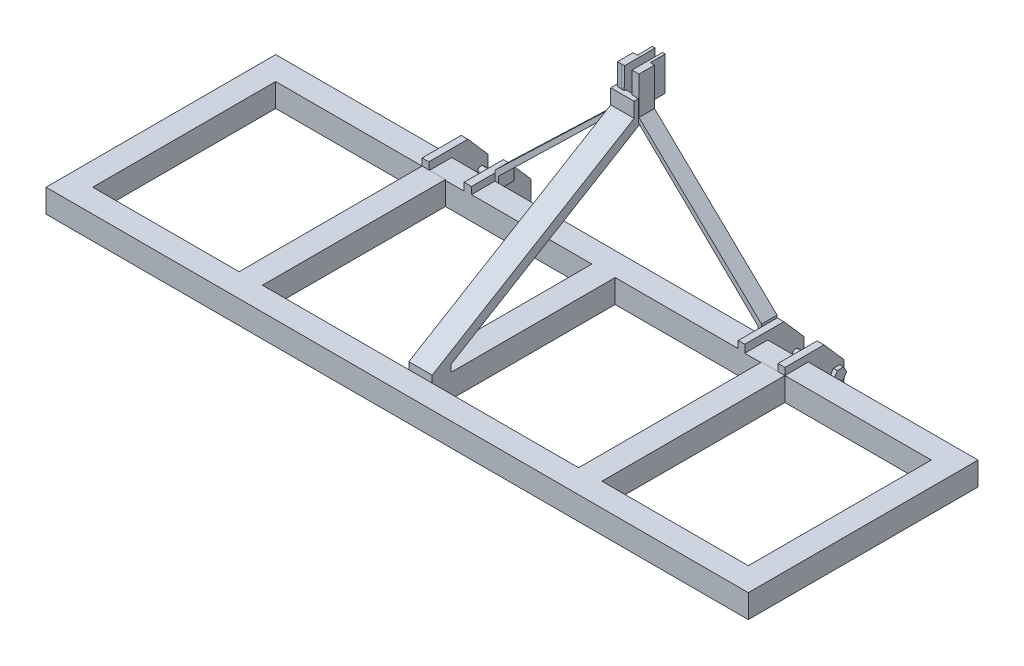
from build123d import *

# Parameters (mm, degrees)
SKETCH1_W            = 37.613618603
SKETCH1_H            = 47.017023253
SKETCH1_W_2          = 37.613618602
BOSS_EXTRUDE1_DEPTH  = 6
BOSS_EXTRUDE2_DEPTH  = 6
MIRROR3_COPY_1_DEPTH = 6
SKETCH6_W            = 8.533488923
SKETCH6_H            = 15.820834786
CUT_EXTRUDE2_DEPTH   = 2
SKETCH7_W            = 8.533488923
SKETCH7_H            = 10.900786406
CUT_EXTRUDE3_DEPTH   = 16
BOSS_EXTRUDE6_DEPTH  = 4
SKETCH9_W            = 9.784219632
SKETCH9_H            = 16.89117049
CUT_EXTRUDE4_DEPTH   = 2
SKETCH10_W           = 9.784219632
SKETCH10_H           = 11.02968992
CUT_EXTRUDE5_DEPTH   = 15
BOSS_EXTRUDE8_DEPTH  = 0.7
BOSS_EXTRUDE9_DEPTH  = 0.7
SKETCH15_W           = 7.842146402
SKETCH15_H           = 8.765171011
BOSS_EXTRUDE11_DEPTH = 0.7
BOSS_EXTRUDE12_DEPTH = 0.7
BOSS_EXTRUDE13_DEPTH = 0.7
BOSS_EXTRUDE15_DEPTH = 6
BOSS_EXTRUDE16_DEPTH = 1
SKETCH25_R           = 0.785617121
BOSS_EXTRUDE17_DEPTH = 13
BOSS_EXTRUDE18_DEPTH = 1
SKETCH27_R           = 0.813635411
BOSS_EXTRUDE19_DEPTH = 12


with BuildPart() as part:
    # Sketch1 → Boss-Extrude1 (new body)
    with BuildSketch(Plane(origin=(0, 0, 0), x_dir=(1, 0, 0), z_dir=(0, 1, 0))):
        Polygon((-163.115635978, 16.680412456), (-163.115635978, -40.614150466), (-163.115635978, -42.336610797), (17.338838432, -42.336610797), (17.338838432, 16.680412456), (16.48228959, 16.680412456), align=None)
        with Locations((-138.308826677, -12.82809917)):
            Rectangle(SKETCH1_W, SKETCH1_H, mode=Mode.SUBTRACT)
        with Locations((-94.695208074, -12.82809917)):
            Rectangle(SKETCH1_W_2, SKETCH1_H, mode=Mode.SUBTRACT)
        with Locations((-51.081589472, -12.82809917)):
            Rectangle(SKETCH1_W, SKETCH1_H, mode=Mode.SUBTRACT)
        with Locations((-7.467970869, -12.82809917)):
            Rectangle(SKETCH1_W_2, SKETCH1_H, mode=Mode.SUBTRACT)
    extrude(amount=BOSS_EXTRUDE1_DEPTH)

    # Sketch2 → Boss-Extrude2 (add)
    with BuildSketch(Plane.ZY.offset(119.502017375)):
        Polygon((-10.680412456, 6), (-10.680412456, 7.806965874), (-20.737358395, 7.806965874), (-25.925828115, 1.87209116), (-25.925828115, -3.073895358), (-25.925828115, -6.20063921), (-20.737358395, 0), (-16.680412456, 0), (-10.680412456, 0), align=None)
    boss_extrude2 = extrude(amount=-BOSS_EXTRUDE2_DEPTH)

    # Mirror2: Boss-Extrude2 across plane
    add(boss_extrude2.mirror(Plane(origin=(-75.888398773, 6, -10.680412456), x_dir=(0, 0, 1), z_dir=(-1, 0, 0))))

    # Mirror3 copy 1 sketch → Mirror3 copy 1 (add)
    with BuildSketch(Plane.ZY.offset(32.27478017)):
        Polygon((-10.680412456, 6), (-10.680412456, 7.806965874), (-20.737358395, 7.806965874), (-25.925828115, 1.87209116), (-25.925828115, -3.073895358), (-25.925828115, -6.20063921), (-20.737358395, 0), (-16.680412456, 0), (-10.680412456, 0), align=None)
    extrude(amount=-MIRROR3_COPY_1_DEPTH)

    # Mirror4: Boss-Extrude2 across plane
    add(boss_extrude2.mirror(Plane.ZY.offset(113.502017375)))

    # Sketch6 → Cut-Extrude2 (cut)
    with BuildSketch(Plane(origin=(0, 7.806965874, 0), x_dir=(1, 0, 0), z_dir=(0, 1, 0))):
        with Locations((-32.321100626, 18.590829849)):
            Rectangle(SKETCH6_W, SKETCH6_H)
    extrude(amount=-CUT_EXTRUDE2_DEPTH, mode=Mode.SUBTRACT)

    # Sketch7 → Cut-Extrude3 (cut)
    with BuildSketch(Plane(origin=(0, 5.806965874, 0), x_dir=(1, 0, 0), z_dir=(0, 1, 0))):
        with Locations((-32.321100626, 22.033512706)):
            Rectangle(SKETCH7_W, SKETCH7_H)
    extrude(amount=-CUT_EXTRUDE3_DEPTH, mode=Mode.SUBTRACT)

    # Sketch8 → Boss-Extrude6 (add)
    with BuildSketch(Plane(origin=(0, 0, -16.680412456), x_dir=(-1, 0, 0), z_dir=(0, 0, -1))):
        Polygon((38.27478017, 4.522273807), (38.27478017, 8.450147148), (69.772707479, 38.666586062), (69.772707479, 48.334730149), (70.874011488, 48.334730149), (70.874011488, 37.278255422), (69.772707479, 37.278255422), (39.158061482, 7.529405606), (39.158061482, 4.522273807), align=None)
    boss_extrude6 = extrude(amount=BOSS_EXTRUDE6_DEPTH)

    # Sketch9 → Cut-Extrude4 (cut)
    with BuildSketch(Plane(origin=(0, 7.806965874, 0), x_dir=(1, 0, 0), z_dir=(0, 1, 0))):
        with Locations((-113.591226463, 19.125997701)):
            Rectangle(SKETCH9_W, SKETCH9_H)
    extrude(amount=-CUT_EXTRUDE4_DEPTH, mode=Mode.SUBTRACT)

    # Sketch10 → Cut-Extrude5 (cut)
    with BuildSketch(Plane(origin=(0, 5.806965874, 0), x_dir=(1, 0, 0), z_dir=(0, 1, 0))):
        with Locations((-113.591226463, 22.097964463)):
            Rectangle(SKETCH10_W, SKETCH10_H)
    extrude(amount=-CUT_EXTRUDE5_DEPTH, mode=Mode.SUBTRACT)

    # Mirror7: Boss-Extrude6 across plane
    add(boss_extrude6.mirror(Plane(origin=(-72.533385445, 0, 0), x_dir=(0, 0, 1), z_dir=(1, 0, 0))))

    # Sketch12 → Boss-Extrude8 (add)
    with BuildSketch(Plane(origin=(-107.502017375, 0, 0), x_dir=(0, 0, -1), z_dir=(1, 0, 0))):
        Polygon((16.680412456, 6), (16.680412456, 0), (20.737358395, 0), (25.925828115, -6.20063921), (25.925828115, 1.87209116), (20.737358395, 7.806965874), (10.680412456, 7.806965874), (10.680412456, 6), align=None)
    extrude(amount=BOSS_EXTRUDE8_DEPTH)

    # Sketch14 → Boss-Extrude9 (add)
    with BuildSketch(Plane(origin=(-118.483336279, 0, 0), x_dir=(0, 0, -1), z_dir=(1, 0, 0))):
        Polygon((16.583119503, 0), (16.583119503, 5.806965874), (10.680412456, 5.806965874), (10.680412456, 7.806965874), (20.737358395, 7.806965874), (25.925828115, 1.87209116), (25.925828115, -6.20063921), (20.737358395, 0), align=None)
    extrude(amount=BOSS_EXTRUDE9_DEPTH)

    # Sketch15 → Boss-Extrude11 (add)
    with BuildSketch(Plane.ZY.offset(70.874011488)):
        with Locations((-20.601485657, 43.952144644)):
            Rectangle(SKETCH15_W, SKETCH15_H)
    extrude(amount=BOSS_EXTRUDE11_DEPTH)

    # Sketch19 → Boss-Extrude12 (add)
    with BuildSketch(Plane(origin=(-74.192759403, 0, 0), x_dir=(0, 0, -1), z_dir=(1, 0, 0))):
        Polygon((20.680412456, 48.334730149), (20.754843595, 39.792896823), (16.566782326, 39.792896823), (16.680412456, 48.334730149), align=None)
    extrude(amount=BOSS_EXTRUDE12_DEPTH)

    # Sketch21 → Boss-Extrude13 (add)
    with BuildSketch(Plane(origin=(-74.192759403, 0, 0), x_dir=(0, 0, -1), z_dir=(1, 0, 0))):
        Polygon((20.754843595, 39.792896823), (24.537534544, 39.792896823), (24.537534544, 48.362951427), (20.680412456, 48.334730149), align=None)
    extrude(amount=BOSS_EXTRUDE13_DEPTH)

    # Sketch23 → Boss-Extrude15 (add)
    with BuildSketch(Plane.ZY.offset(75.888398773)):
        Polygon((36.336610797, 6), (36.336610797, 7.794899668), (-15.54173244, 38.987033262), (-15.54173244, 42.801373137), (-17.017265085, 42.801373137), (-17.017265085, 38.335404827), (-17.017265085, 36.955229626), (31.491887766, 7.794899668), (31.491887766, 4.688712486), (36.336610797, 4.688712486), align=None)
    extrude(amount=-BOSS_EXTRUDE15_DEPTH)

    # Sketch24 → Boss-Extrude16 (add)
    with BuildSketch(Plane.ZY.offset(119.502017375)):
        Polygon((-22.278203382, -0.491017032), (-23.054410428, 0.85341301), (-24.606824521, 0.85341301), (-25.383031568, -0.491017032), (-24.606824521, -1.835447074), (-23.054410428, -1.835447074), align=None)
    extrude(amount=BOSS_EXTRUDE16_DEPTH)

    # Sketch25 → Boss-Extrude17 (add)
    with BuildSketch(Plane(origin=(-106.802017375, 0, 0), x_dir=(0, 0, -1), z_dir=(1, 0, 0))):
        with Locations((24.059849536, -0.571927467)):
            Circle(SKETCH25_R)
    extrude(amount=-BOSS_EXTRUDE17_DEPTH)

    # Sketch26 → Boss-Extrude18 (add)
    with BuildSketch(Plane(origin=(-26.27478017, 0, 0), x_dir=(0, 0, -1), z_dir=(1, 0, 0))):
        Polygon((25.53835309, 0), (24.736565321, 1.388737154), (23.132989782, 1.388737154), (22.331202013, 0), (23.132989782, -1.388737154), (24.736565321, -1.388737154), align=None)
    extrude(amount=BOSS_EXTRUDE18_DEPTH)

    # Sketch27 → Boss-Extrude19 (add)
    with BuildSketch(Plane.ZY.offset(38.27478017)):
        with Locations((-23.747895792, -0.52869674)):
            Circle(SKETCH27_R)
    extrude(amount=-BOSS_EXTRUDE19_DEPTH)


solid = part.part
